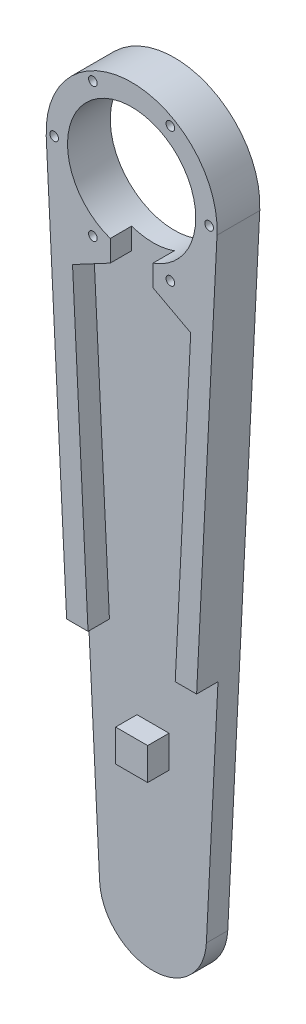
from build123d import *

# Parameters (mm, degrees)
SKETCH1_R                       = 40
SKETCH1_R_2                     = 30
BOSS_EXTRUDE1_DEPTH             = 10
M4X0_7_TAPPED_HOLE1_D           = 3.3
M4X0_7_TAPPED_HOLE1_CSINK_D     = 4.05
M4X0_7_TAPPED_HOLE1_CSINK_ANGLE = 90
CIRPATTERN1_COUNT               = 6
SKETCH14_R                      = 25
BOSS_EXTRUDE5_DEPTH             = 10
BOSS_EXTRUDE7_START             = 10
SKETCH15_W                      = 7.5
SKETCH15_H                      = 15
SKETCH15_R                      = 2.025
BOSS_EXTRUDE7_DEPTH             = 10


with BuildPart() as part:
    # Sketch1 → Boss-Extrude1 (new body)
    with BuildSketch(Plane.XY):
        Circle(SKETCH1_R)
        Circle(SKETCH1_R_2, mode=Mode.SUBTRACT)
    extrude(amount=-BOSS_EXTRUDE1_DEPTH)

    # M4x0.7 Tapped Hole1 (through all)
    with Locations(Plane.XY):
        with Locations((36.25, 0)):
            m4x0_7_tapped_hole1 = CounterSinkHole(M4X0_7_TAPPED_HOLE1_D / 2, M4X0_7_TAPPED_HOLE1_CSINK_D / 2, counter_sink_angle=M4X0_7_TAPPED_HOLE1_CSINK_ANGLE)

    # CirPattern1: M4x0.7 Tapped Hole1 ×6 about axis
    cirpattern1_axis = Axis((0, 0, 0), (0, 0, 1))
    for i in range(1, CIRPATTERN1_COUNT):
        add(m4x0_7_tapped_hole1.rotate(cirpattern1_axis, i * 360 / CIRPATTERN1_COUNT), mode=Mode.SUBTRACT)

    # Sketch14 → Boss-Extrude5 (add)
    with BuildSketch(Plane.XY):
        with BuildLine():
            ThreePointArc((39.949968711, -2), (0, -40), (-39.949968711, -2))
            Line((-39.949968711, -2), (-24.968730444, -301.25))
            ThreePointArc((-24.968730444, -301.25), (-0.625195526, -275.007818612), (25, -300))
            ThreePointArc((25, -300), (24.992181388, -300.625195526), (24.968730444, -301.25))
            Line((24.968730444, -301.25), (39.949968711, -2))
        make_face()
        with Locations((0, -300)):
            Circle(SKETCH14_R)
    extrude(amount=-BOSS_EXTRUDE5_DEPTH)

    # Sketch15 → Boss-Extrude7 (add)
    # profile 1 of 4: a face of its own
    with BuildSketch(Plane.XY.offset(BOSS_EXTRUDE7_START)):
        with Locations((3.75, -232.5)):
            Rectangle(SKETCH15_W, SKETCH15_H)
    # profile 2 of 4: a face of its own
    with BuildSketch(Plane.XY.offset(BOSS_EXTRUDE7_START)):
        with Locations((-3.75, -232.5)):
            Rectangle(SKETCH15_W, SKETCH15_H)
    # profile 3 of 4: a face of its own
    with BuildSketch(Plane.XY.offset(BOSS_EXTRUDE7_START)):
        with BuildLine():
            Line((20.390984754, -192.690398552), (30.40350824, -192.690398552))
            Line((30.40350824, -192.690398552), (39.949968711, -2))
            ThreePointArc((39.949968711, -2), (28.982753492, 27.568097504), (0, 40))
            Line((0, 40), (0, 30))
            ThreePointArc((0, 30), (21.213203436, 21.213203436), (30, 0))
            ThreePointArc((30, 0), (24.494897428, -17.320508076), (10, -28.284271247))
            Line((10, -28.284271247), (10, -38.284271247))
            Line((10, -38.284271247), (27.650064281, -47.690398552))
            Line((27.650064281, -47.690398552), (20.390984754, -192.690398552))
        make_face()
        with Locations((18.125, -31.393420887)):
            Circle(SKETCH15_R, mode=Mode.SUBTRACT)
        with Locations((18.125, 31.393420887)):
            Circle(SKETCH15_R, mode=Mode.SUBTRACT)
        with Locations((36.25, 0)):
            Circle(SKETCH15_R, mode=Mode.SUBTRACT)
    # profile 4 of 4: a face of its own
    with BuildSketch(Plane.XY.offset(BOSS_EXTRUDE7_START)):
        with BuildLine():
            Line((-39.949968711, -2), (-30.40350824, -192.690398552))
            Line((-30.40350824, -192.690398552), (-20.390984754, -192.690398552))
            Line((-20.390984754, -192.690398552), (-27.650064281, -47.690398552))
            Line((-27.650064281, -47.690398552), (-10, -38.284271247))
            Line((-10, -38.284271247), (-10, -28.284271247))
            ThreePointArc((-10, -28.284271247), (-29.56795679, 5.073059362), (0, 30))
            Line((0, 30), (0, 40))
            ThreePointArc((0, 40), (-28.982753492, 27.568097504), (-39.949968711, -2))
        make_face()
        with Locations((-36.25, 0)):
            Circle(SKETCH15_R, mode=Mode.SUBTRACT)
        with Locations((-18.125, -31.393420887)):
            Circle(SKETCH15_R, mode=Mode.SUBTRACT)
        with Locations((-18.125, 31.393420887)):
            Circle(SKETCH15_R, mode=Mode.SUBTRACT)
    extrude(amount=-BOSS_EXTRUDE7_DEPTH)


solid = part.part
